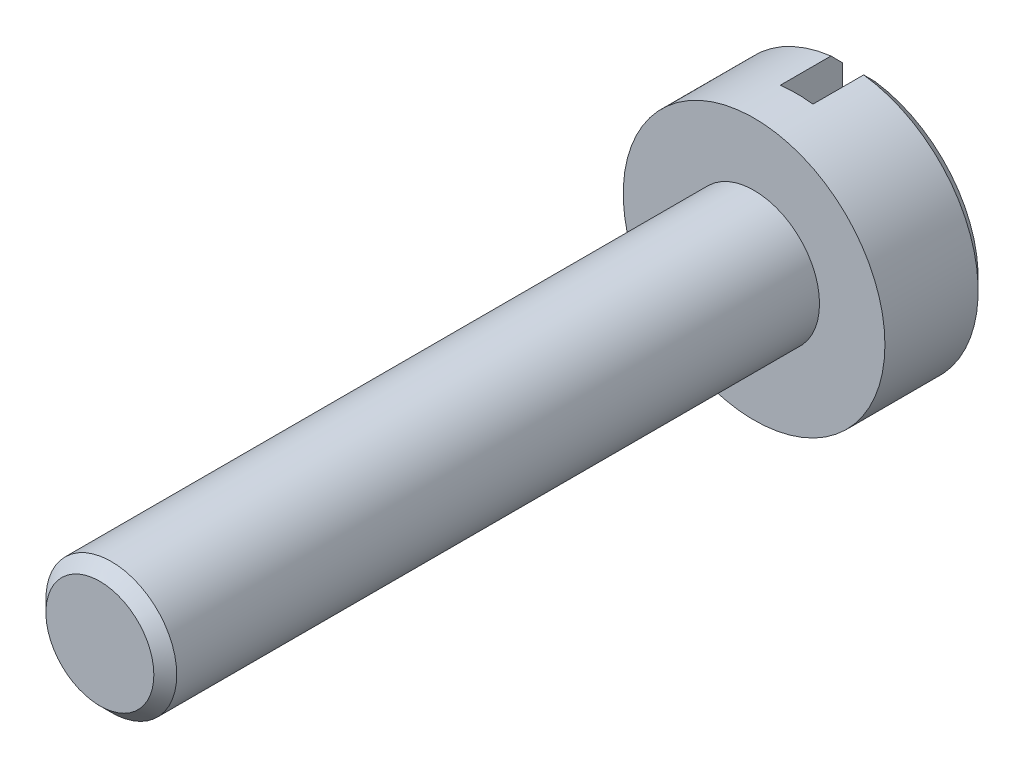
from build123d import *

# Parameters (mm, degrees)
SKETCH_1_R          = 4
EXTRUDE_1_DEPTH     = 3.2
SKETCH_2_R          = 2
EXTRUDE_2_DEPTH     = 20
CUT_EXTRUDE_1_DEPTH = 1.9
CHAMFER_1_SIZE      = 0.35


with BuildPart() as part:
    # Эскиз1 → Вытянуть1 (new body)
    with BuildSketch(Plane.XY):
        with Locations(Location((0, 0, 0), (0, 0, 97.180755781))):
            Circle(SKETCH_1_R)
    extrude(amount=EXTRUDE_1_DEPTH)

    # Эскиз2 → Вытянуть2 (add)
    with BuildSketch(Plane.XY.offset(3.2)):
        with Locations((0, 0.08601646)):
            Circle(SKETCH_2_R)
    extrude(amount=EXTRUDE_2_DEPTH)

    # Эскиз3 → Вырез-Вытянуть1 (cut)
    with BuildSketch(Plane(origin=(0, 0, 0), x_dir=(-1, 0, 0), z_dir=(0, 0, -1))):
        Polygon((0.5, 4.203337699), (0.5, -4.490059234), (-0.5, -4.7079676), (-0.5, 4.570341264), align=None)
    extrude(amount=-CUT_EXTRUDE_1_DEPTH, mode=Mode.SUBTRACT)

    # Фаска1
    chamfer_1_edges = [part.edges().sort_by_distance(p)[0] for p in [
        (-4, 0, 0),
        (4, 0, 0),
        (-2, 0.08601646, 23.2),
    ]]
    chamfer(chamfer_1_edges, length=CHAMFER_1_SIZE)


solid = part.part
